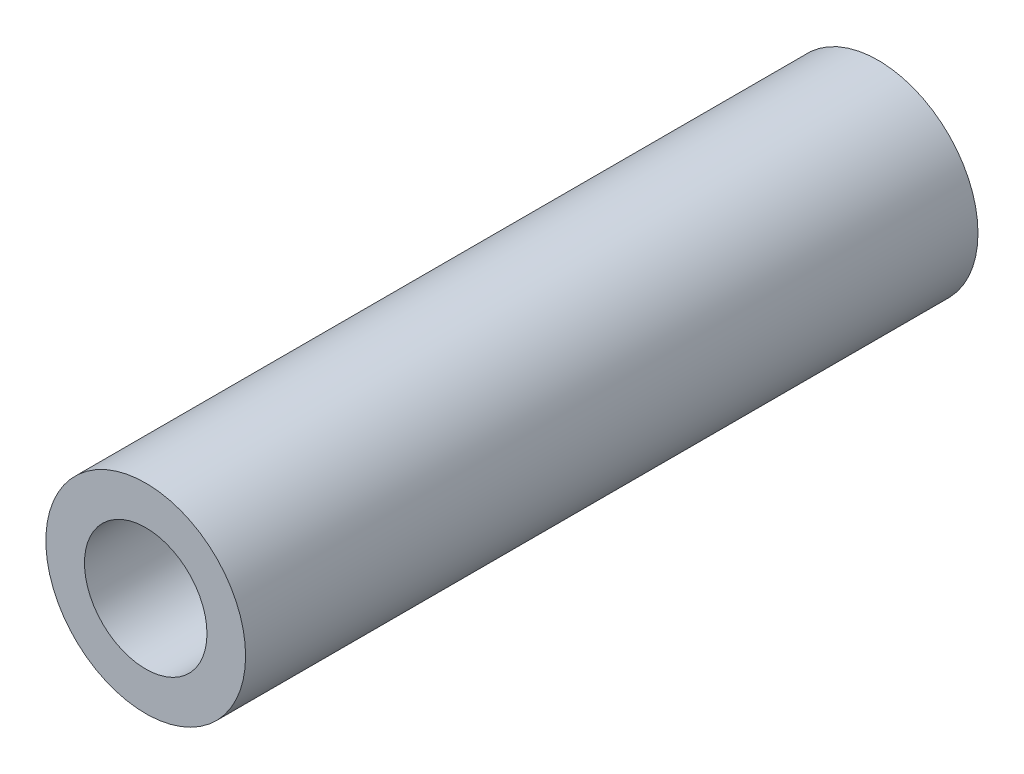
from build123d import *

# Parameters (mm, degrees)
SKETCH1_R      = 2.38125
SKETCH1_R_2    = 1.4605
EXTRUDE1_DEPTH = 8.73125


with BuildPart() as part:
    # Sketch1 → Extrude1 (new, symmetric)
    with BuildSketch(Plane.XY):
        Circle(SKETCH1_R)
        Circle(SKETCH1_R_2, mode=Mode.SUBTRACT)
    extrude(amount=EXTRUDE1_DEPTH, both=True)


solid = part.part
